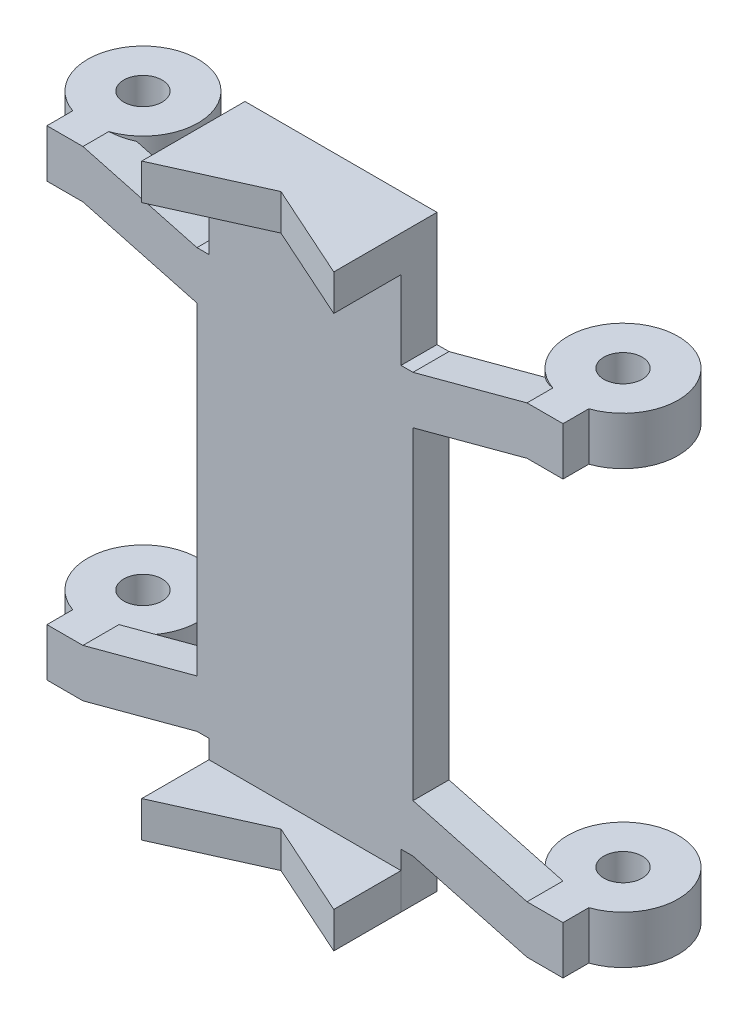
from build123d import *

# Parameters (mm, degrees)
SKETCH2_R             = 4.6
SKETCH2_R_2           = 1.6
BOSS_EXTRUDE1_DEPTH   = 4
BOSS_EXTRUDE1_2_DEPTH = 4
LPATTERN1_COUNT       = 2
LPATTERN1_PITCH       = 36
BOSS_EXTRUDE5_DEPTH   = 3
BOSS_EXTRUDE6_START   = 4.8
B_E_SPRING_PLATE_R    = 1.7
BOSS_EXTRUDE6_DEPTH   = 2.4
SKETCH10_W            = 16
SKETCH10_H            = 49
BOSS_EXTRUDE8_DEPTH   = 3
BOSS_EXTRUDE7_START   = -2
BOSS_EXTRUDE7_DEPTH   = 3
BOSS_EXTRUDE9_START   = 44
BOSS_EXTRUDE9_DEPTH   = 3


with BuildPart() as part:
    # Sketch2 → Boss-Extrude1 (new body)
    with BuildSketch(Plane(origin=(0, 0, 0), x_dir=(1, 0, 0), z_dir=(0, 1, 0))):
        with Locations(Location((-20, 0, 0), (0, 0, 270))):
            Circle(SKETCH2_R)
        with Locations(Location((-20, 0, 0), (0, 0, 270))):
            Circle(SKETCH2_R_2, mode=Mode.SUBTRACT)
    boss_extrude1 = extrude(amount=BOSS_EXTRUDE1_DEPTH)



with BuildPart() as body_2:
    # Sketch2 → Boss-Extrude1 2 (new body)
    with BuildSketch(Plane(origin=(0, 0, 0), x_dir=(1, 0, 0), z_dir=(0, 1, 0))):
        with Locations(Location((20, 0, 0), (0, 0, 270))):
            Circle(SKETCH2_R)
        with Locations(Location((20, 0, 0), (0, 0, 270))):
            Circle(SKETCH2_R_2, mode=Mode.SUBTRACT)
    boss_extrude1_2 = extrude(amount=BOSS_EXTRUDE1_2_DEPTH)


with BuildPart() as lpattern1_1:
    # LPattern1: pattern copy
    add(boss_extrude1.moved(Location(Vector(0, 1, 0) * (1 * LPATTERN1_PITCH))))


with BuildPart() as lpattern1_2:
    # LPattern1: pattern copy
    add(boss_extrude1_2.moved(Location(Vector(0, 1, 0) * (1 * LPATTERN1_PITCH))))


with BuildPart() as part_1:
    add(part.part)

    add(body_2.part)  # Boss-Extrude5 merges body 2

    add(lpattern1_1.part)  # Boss-Extrude5 merges LPattern1_1

    add(lpattern1_2.part)  # Boss-Extrude5 merges LPattern1_2
    # Sketch7 → Boss-Extrude5 (add)
    with BuildSketch(Plane.XY.offset(3.5)):
        Polygon((-21.5, 0), (-21.5, 4), (-18.5, 4), (-9, 6.545517328), (-9, 33.454482672), (-18.5, 36), (-21.5, 36), (-21.5, 40), (-18.5, 40), (-9, 37.454482672), (9, 37.454482672), (18.5, 40), (21.5, 40), (21.5, 36), (18.5, 36), (9, 33.454482672), (9, 6.545517328), (18.5, 4), (21.5, 4), (21.5, 0), (18.5, 0), (9, 2.545517328), (-9, 2.545517328), (-18.5, 0), align=None)
    extrude(amount=BOSS_EXTRUDE5_DEPTH)

    # b.e. spring plate → Boss-Extrude6 (add)
    with BuildSketch(Plane(origin=(0, 0, 0), x_dir=(1, 0, 0), z_dir=(0, 1, 0)).offset(BOSS_EXTRUDE6_START)):
        with BuildLine():
            Line((-3.3, 0), (-3.3, -3.5))
            Line((-3.3, -3.5), (3.3, -3.5))
            Line((3.3, -3.5), (3.3, 0))
            ThreePointArc((3.3, 0), (0, 3.3), (-3.3, 0))
        make_face()
        with Locations(Location((0, 0, 0), (0, 0, 270))):
            Circle(B_E_SPRING_PLATE_R, mode=Mode.SUBTRACT)
    extrude(amount=BOSS_EXTRUDE6_DEPTH)

    # Sketch10 → Boss-Extrude8 (add)
    with BuildSketch(Plane.XY.offset(6.5)):
        with Locations((0, 22.5)):
            Rectangle(SKETCH10_W, SKETCH10_H)
    extrude(amount=-BOSS_EXTRUDE8_DEPTH)

    # b.e. pen holder<3> → Boss-Extrude9 (add)
    with BuildSketch(Plane(origin=(0, 0, 0), x_dir=(1, 0, 0), z_dir=(0, 1, 0)).offset(BOSS_EXTRUDE9_START)):
        Polygon((-8, -6.5), (-8, -12.1), (0, -8.5), (8, -12.1), (8, -6.5), align=None)
    extrude(amount=BOSS_EXTRUDE9_DEPTH)


with BuildPart() as body_2_2:
    # b.e. pen holder → Boss-Extrude7 (new body)
    with BuildSketch(Plane(origin=(0, 0, 0), x_dir=(1, 0, 0), z_dir=(0, 1, 0)).offset(BOSS_EXTRUDE7_START)):
        Polygon((-8, -6.5), (-8, -12.1), (0, -8.5), (8, -12.1), (8, -6.5), align=None)
    extrude(amount=BOSS_EXTRUDE7_DEPTH)


solid = Compound([part_1.part, body_2_2.part])
